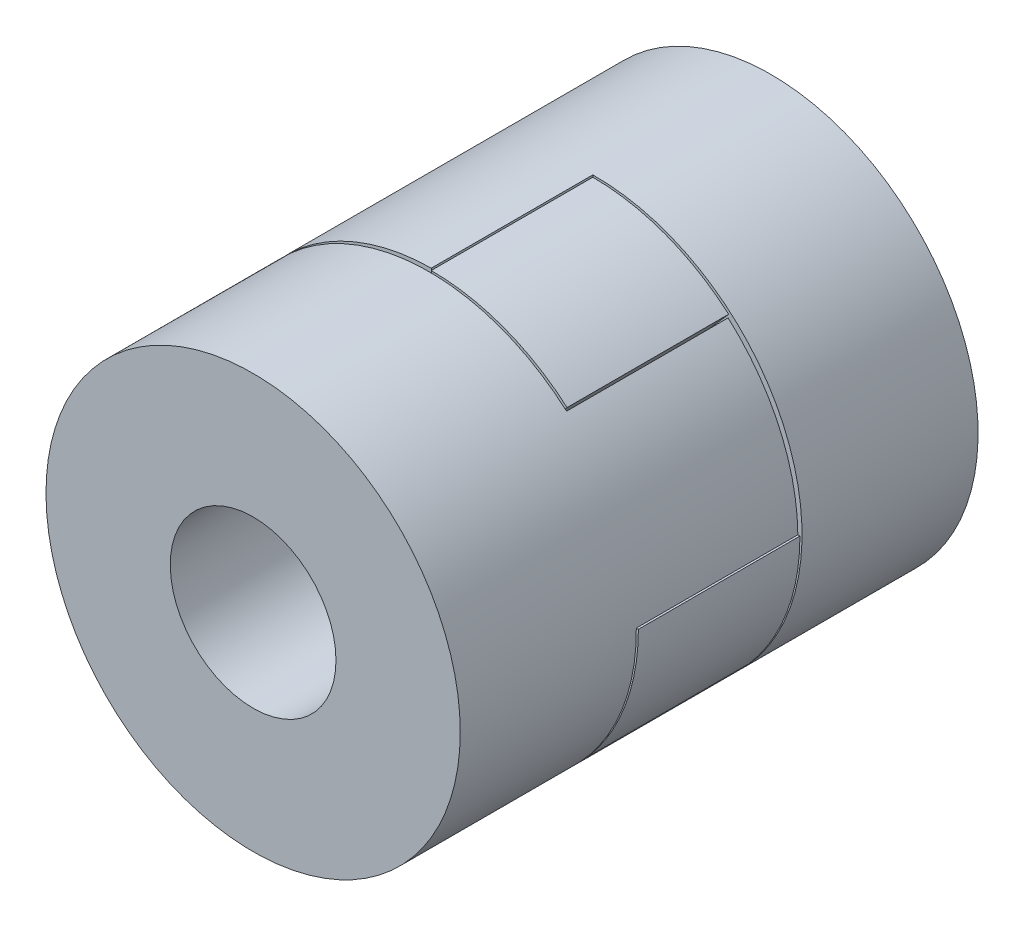
from build123d import *
from build123d.topology import SkipClean

# Parameters (mm, degrees)
BOSS_EXTRUDE1_DEPTH   = 3.9
BOSS_EXTRUDE1_2_DEPTH = 3.9
BOSS_EXTRUDE1_3_DEPTH = 3.9
BOSS_EXTRUDE1_4_DEPTH = 3.9
SKETCH2_R             = 10
SKETCH2_R_2           = 4
BOSS_EXTRUDE2_DEPTH   = 8.5
BOSS_EXTRUDE3_DEPTH   = 7.8
SKETCH4_R             = 10
SKETCH4_R_2           = 2.5
BOSS_EXTRUDE5_DEPTH   = 8.5
BOSS_EXTRUDE6_START   = 7.8
BOSS_EXTRUDE6_DEPTH   = 7.8


with BuildPart() as part:
    # Sketch1 → Boss-Extrude1 (new, symmetric)
    with BuildSketch(Plane.XY):
        with BuildLine():
            ThreePointArc((0, 10), (3.5, 9.367496998), (6.557247898, 7.55))
            Line((6.557247898, 7.55), (0, 0))
            Line((0, 0), (0, 10))
        make_face()
    extrude(amount=BOSS_EXTRUDE1_DEPTH, both=True)


with BuildPart() as body_2:
    # Sketch1 → Boss-Extrude1 2 (new, symmetric)
    with BuildSketch(Plane.XY):
        with BuildLine():
            ThreePointArc((10, 0), (9.367496998, -3.5), (7.55, -6.557247898))
            Line((7.55, -6.557247898), (0, 0))
            Line((0, 0), (10, 0))
        make_face()
    extrude(amount=BOSS_EXTRUDE1_2_DEPTH, both=True)


with BuildPart() as body_3:
    # Sketch1 → Boss-Extrude1 3 (new, symmetric)
    with BuildSketch(Plane.XY):
        with BuildLine():
            ThreePointArc((0, -10), (-3.5, -9.367496998), (-6.557247898, -7.55))
            Line((-6.557247898, -7.55), (0, 0))
            Line((0, 0), (0, -10))
        make_face()
    extrude(amount=BOSS_EXTRUDE1_3_DEPTH, both=True)


with BuildPart() as body_4:
    # Sketch1 → Boss-Extrude1 4 (new, symmetric)
    with BuildSketch(Plane.XY):
        with BuildLine():
            ThreePointArc((-10, 0), (-9.367496998, 3.5), (-7.55, 6.557247898))
            Line((-7.55, 6.557247898), (0, 0))
            Line((0, 0), (-10, 0))
        make_face()
    extrude(amount=BOSS_EXTRUDE1_4_DEPTH, both=True)


with BuildPart() as body_5:
    # Sketch2 → Boss-Extrude2 (new body)
    with BuildSketch(Plane.XY.offset(4)):
        Circle(SKETCH2_R)
        Circle(SKETCH2_R_2, mode=Mode.SUBTRACT)
    extrude(amount=BOSS_EXTRUDE2_DEPTH)

    # Sketch3 → Boss-Extrude3 (add)
    with SkipClean():  # the faces are left unmerged after this step: merging them gives an invalid solid
        with BuildSketch(Plane(origin=(0, 0, 4), x_dir=(-1, 0, 0), z_dir=(0, 0, -1))):
            with BuildLine():
                Line((-6.632420028, 7.484050012), (-0.219301297, 0.1))
                Line((-0.219301297, 0.1), (-9.999499987, 0.1))
                ThreePointArc((-9.999499987, 0.1), (-9.098694384, 4.148946916), (-6.632420028, 7.484050012))
            make_face()
            with BuildLine():
                Line((9.999499987, -0.1), (0.219301297, -0.1))
                Line((0.219301297, -0.1), (6.632420028, -7.484050012))
                ThreePointArc((6.632420028, -7.484050012), (9.098694384, -4.148946916), (9.999499987, -0.1))
            make_face()
        extrude(amount=BOSS_EXTRUDE3_DEPTH)


with BuildPart() as body_6:
    # Sketch4 → Boss-Extrude5 (new body)
    with BuildSketch(Plane(origin=(0, 0, -4), x_dir=(-1, 0, 0), z_dir=(0, 0, -1))):
        Circle(SKETCH4_R)
        Circle(SKETCH4_R_2, mode=Mode.SUBTRACT)
    extrude(amount=BOSS_EXTRUDE5_DEPTH)

    # Sketch5 → Boss-Extrude6 (add)
    with BuildSketch(Plane.XY.offset(-4).offset(BOSS_EXTRUDE6_START)):
        with BuildLine():
            Line((0.1, -0.219301297), (7.484050012, -6.632420028))
            ThreePointArc((7.484050012, -6.632420028), (4.148946916, -9.098694384), (0.1, -9.999499987))
            Line((0.1, -9.999499987), (0.1, -0.219301297))
        make_face()
        with BuildLine():
            Line((-0.1, 0.219301297), (-7.484050012, 6.632420028))
            ThreePointArc((-7.484050012, 6.632420028), (-4.148946916, 9.098694384), (-0.1, 9.999499987))
            Line((-0.1, 9.999499987), (-0.1, 0.219301297))
        make_face()
    extrude(amount=-BOSS_EXTRUDE6_DEPTH)


solid = Compound([part.part, body_2.part, body_3.part, body_4.part, body_5.part, body_6.part])
